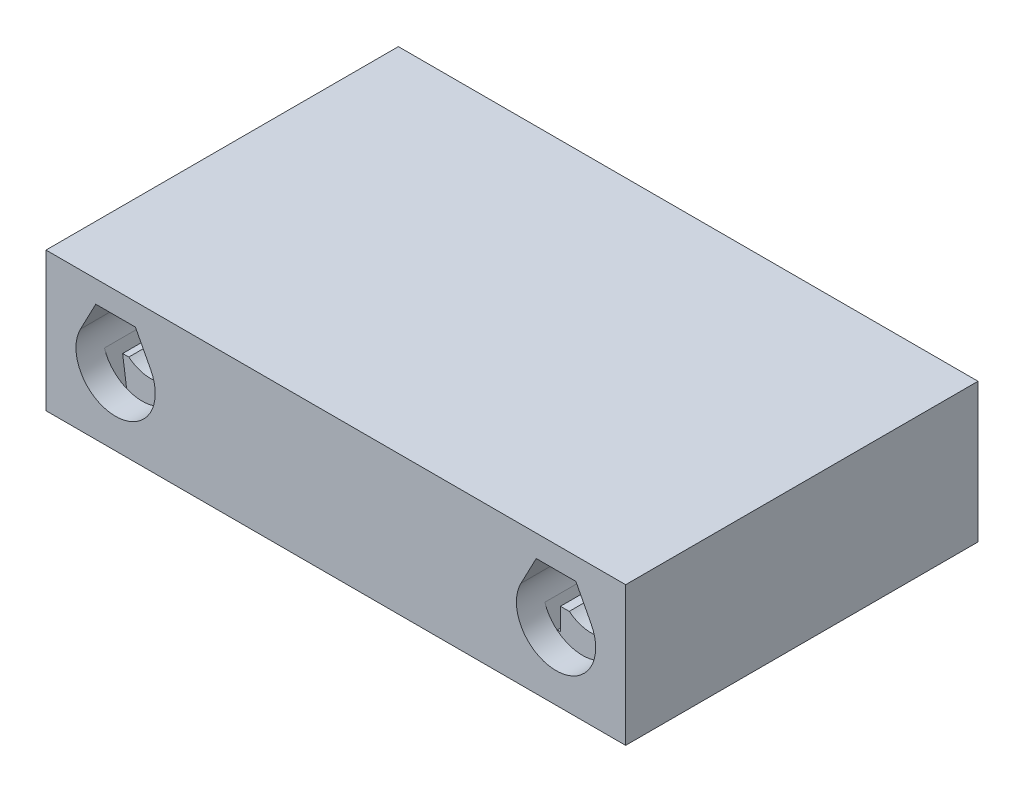
from build123d import *
from build123d.topology import SkipClean

# Parameters (mm, degrees)
SCHIZZO2_W            = 65.8
SCHIZZO2_H            = 15.8
FRONT_DEPTH           = 1.5
INNER_DEPTH           = 34
FRONT_CLEARANCE_DEPTH = 1
BACK_START            = -1
BACK_CLEARANCE_DEPTH  = 1
SCHIZZO7_W            = 65.8
SCHIZZO7_H            = 15.8
BACK_DEPTH            = 2
SCHIZZO9_W            = 65.8
SCHIZZO9_H            = 15.8
BACK_CLOSING_DEPTH    = 1


with BuildPart() as part:
    # Schizzo2 → Front (new, symmetric)
    with BuildSketch(Plane.XY):
        Rectangle(SCHIZZO2_W, SCHIZZO2_H)
        with BuildLine():
            Line((-27.25, 5.4), (-22.75, 5.4))
            Line((-22.75, 5.4), (-21.014451547, 2.089354811))
            ThreePointArc((-21.014451547, 2.089354811), (-25, -4.5), (-28.985548453, 2.089354811))
            Line((-28.985548453, 2.089354811), (-27.25, 5.4))
        make_face(mode=Mode.SUBTRACT)
        with BuildLine():
            Line((27.25, 5.4), (22.75, 5.4))
            Line((22.75, 5.4), (21.014451547, 2.089354811))
            ThreePointArc((21.014451547, 2.089354811), (25, -4.5), (28.985548453, 2.089354811))
            Line((28.985548453, 2.089354811), (27.25, 5.4))
        make_face(mode=Mode.SUBTRACT)
    extrude(amount=FRONT_DEPTH, both=True)

    # Schizzo5 → Inner (add)
    with SkipClean():  # the faces are left unmerged after this step: merging them gives an invalid solid
        with BuildSketch(Plane(origin=(0, 0, -1.5), x_dir=(-1, 0, 0), z_dir=(0, 0, -1))):
            with BuildLine():
                Line((-25, -7.9), (-27.35991702, -7.9))
                Line((-27.35991702, -7.9), (-28.2, -1.922498999))
                Line((-28.2, -1.922498999), (-27.5, -1.922498999))
                ThreePointArc((-27.5, -1.922498999), (-25, -2.8), (-22.5, -1.922498999))
                Line((-22.5, -1.922498999), (-21.5, -1.922498999))
                Line((-21.5, -1.922498999), (-21.5, -4.422498999))
                Line((-21.5, -4.422498999), (-21.15, -4.422498999))
                Line((-21.15, -4.422498999), (-20.726632237, -1.410080834))
                ThreePointArc((-20.726632237, -1.410080834), (-20.515143622, 0.368867555), (-21.014451547, 2.089354811))
                Line((-21.014451547, 2.089354811), (-22.75, 5.4))
                Line((-22.75, 5.4), (-27.25, 5.4))
                Line((-27.25, 5.4), (-28.985548453, 2.089354811))
                ThreePointArc((-28.985548453, 2.089354811), (-29.485161475, 0.365139069), (-29.271017396, -1.417183969))
                Line((-29.271017396, -1.417183969), (-28.35991702, -7.9))
                Line((-28.35991702, -7.9), (-32.9, -7.9))
                Line((-32.9, -7.9), (-32.9, 7.9))
                Line((-32.9, 7.9), (32.9, 7.9))
                Line((32.9, 7.9), (32.9, -7.9))
                Line((32.9, -7.9), (28.35991702, -7.9))
                Line((28.35991702, -7.9), (29.271017396, -1.417183969))
                ThreePointArc((29.271017396, -1.417183969), (29.485161475, 0.365139069), (28.985548453, 2.089354811))
                Line((28.985548453, 2.089354811), (27.25, 5.4))
                Line((27.25, 5.4), (22.75, 5.4))
                Line((22.75, 5.4), (21.014451547, 2.089354811))
                ThreePointArc((21.014451547, 2.089354811), (20.515143622, 0.368867555), (20.726632237, -1.410080834))
                Line((20.726632237, -1.410080834), (21.15, -4.422498999))
                Line((21.15, -4.422498999), (21.5, -4.422498999))
                Line((21.5, -4.422498999), (21.5, -1.922498999))
                Line((21.5, -1.922498999), (22.5, -1.922498999))
                ThreePointArc((22.5, -1.922498999), (25, -2.8), (27.5, -1.922498999))
                Line((27.5, -1.922498999), (28.2, -1.922498999))
                Line((28.2, -1.922498999), (27.35991702, -7.9))
                Line((27.35991702, -7.9), (25, -7.9))
                Line((25, -7.9), (21.638730893, -7.9))
                Line((21.638730893, -7.9), (-21.638730893, -7.9))
                Line((-21.638730893, -7.9), (-25, -7.9))
            make_face()
        extrude(amount=INNER_DEPTH)

    # Schizzo13 → Front clearance (cut)
    with BuildSketch(Plane.XY.offset(-1.5)):
        with BuildLine():
            Line((-21.5, -2.828427125), (-21.5, -4.422498999))
            Line((-21.5, -4.422498999), (-21.15, -4.422498999))
            Line((-21.15, -4.422498999), (-21.155384602, -4.46081243))
            Line((-21.155384602, -4.46081243), (-21.638730893, -7.9))
            Line((-21.638730893, -7.9), (-27.35991702, -7.9))
            Line((-27.35991702, -7.9), (-27.998629063, -3.355327665))
            Line((-27.998629063, -3.355327665), (-28.2, -1.922498999))
            Line((-28.2, -1.922498999), (-27.5, -1.922498999))
            ThreePointArc((-27.5, -1.922498999), (-25, -2.8), (-22.5, -1.922498999))
            Line((-22.5, -1.922498999), (-21.5, -1.922498999))
            Line((-21.5, -1.922498999), (-21.5, -2.828427125))
        make_face()
        with BuildLine():
            Line((21.155384602, -4.46081243), (21.638730893, -7.9))
            Line((21.638730893, -7.9), (27.35991702, -7.9))
            Line((27.35991702, -7.9), (27.998629063, -3.355327665))
            Line((27.998629063, -3.355327665), (28.2, -1.922498999))
            Line((28.2, -1.922498999), (27.5, -1.922498999))
            ThreePointArc((27.5, -1.922498999), (25, -2.8), (22.5, -1.922498999))
            Line((22.5, -1.922498999), (21.5, -1.922498999))
            Line((21.5, -1.922498999), (21.5, -2.828427125))
            Line((21.5, -2.828427125), (21.5, -4.422498999))
            Line((21.5, -4.422498999), (21.15, -4.422498999))
            Line((21.15, -4.422498999), (21.155384602, -4.46081243))
        make_face()
    extrude(amount=-FRONT_CLEARANCE_DEPTH, mode=Mode.SUBTRACT)

    # Schizzo12 → Back clearance (cut)
    with BuildSketch(Plane(origin=(0, 0, -35.5), x_dir=(-1, 0, 0), z_dir=(0, 0, -1)).offset(BACK_START)):
        with BuildLine():
            Line((21.5, -1.922498999), (21.5, -4.422498999))
            Line((21.5, -4.422498999), (21.15, -4.422498999))
            Line((21.15, -4.422498999), (21.638730893, -7.9))
            Line((21.638730893, -7.9), (27.35991702, -7.9))
            Line((27.35991702, -7.9), (28.2, -1.922498999))
            Line((28.2, -1.922498999), (27.5, -1.922498999))
            ThreePointArc((27.5, -1.922498999), (25, -2.8), (22.5, -1.922498999))
            Line((22.5, -1.922498999), (21.5, -1.922498999))
        make_face()
        with BuildLine():
            Line((-27.35991702, -7.9), (-21.638730893, -7.9))
            Line((-21.638730893, -7.9), (-21.15, -4.422498999))
            Line((-21.15, -4.422498999), (-21.5, -4.422498999))
            Line((-21.5, -4.422498999), (-21.5, -1.922498999))
            Line((-21.5, -1.922498999), (-22.5, -1.922498999))
            ThreePointArc((-22.5, -1.922498999), (-25, -2.8), (-27.5, -1.922498999))
            Line((-27.5, -1.922498999), (-28.2, -1.922498999))
            Line((-28.2, -1.922498999), (-27.35991702, -7.9))
        make_face()
    extrude(amount=BACK_CLEARANCE_DEPTH, mode=Mode.SUBTRACT)

    # Schizzo7 → Back (add)
    with BuildSketch(Plane(origin=(0, 0, -35.5), x_dir=(-1, 0, 0), z_dir=(0, 0, -1))):
        Rectangle(SCHIZZO7_W, SCHIZZO7_H)
        with BuildLine():
            Line((22.75, 5.4), (21.014451547, 2.089354811))
            ThreePointArc((21.014451547, 2.089354811), (25, -4.5), (28.985548453, 2.089354811))
            Line((28.985548453, 2.089354811), (27.25, 5.4))
            Line((27.25, 5.4), (22.75, 5.4))
        make_face(mode=Mode.SUBTRACT)
        with BuildLine():
            Line((-27.25, 5.4), (-22.75, 5.4))
            Line((-22.75, 5.4), (-21.014451547, 2.089354811))
            ThreePointArc((-21.014451547, 2.089354811), (-25, -4.5), (-28.985548453, 2.089354811))
            Line((-28.985548453, 2.089354811), (-27.25, 5.4))
        make_face(mode=Mode.SUBTRACT)
    extrude(amount=BACK_DEPTH)

    # Schizzo9 → Back closing (add)
    with BuildSketch(Plane(origin=(0, 0, -37.5), x_dir=(-1, 0, 0), z_dir=(0, 0, -1))):
        Rectangle(SCHIZZO9_W, SCHIZZO9_H)
    extrude(amount=BACK_CLOSING_DEPTH)


solid = part.part
